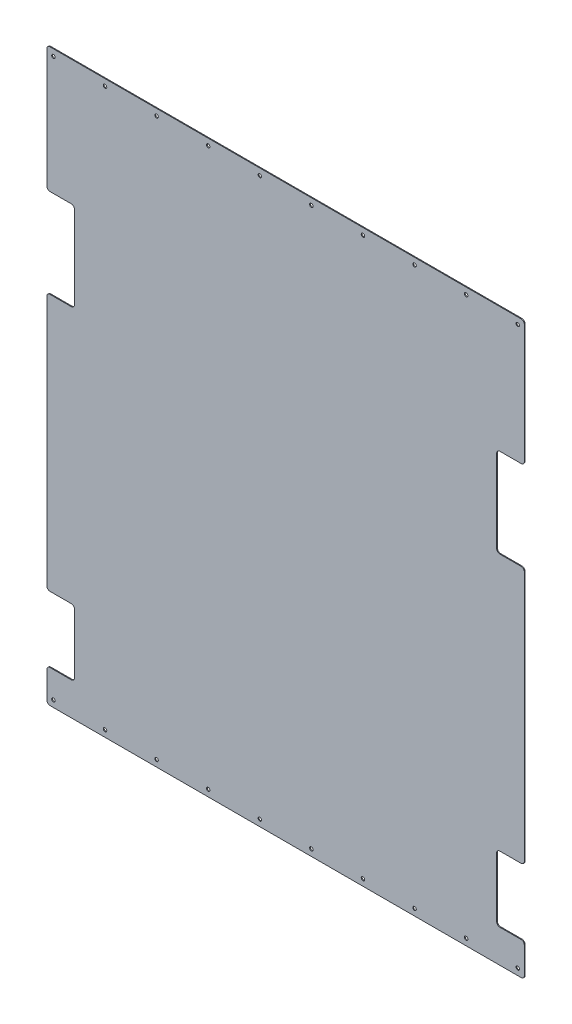
from build123d import *

# Parameters (mm, degrees)
SKETCH1_W           = 724
SKETCH1_H           = 865
BOSS_EXTRUDE1_DEPTH = 1.27
SKETCH2_W           = 42
SKETCH2_H           = 135
SKETCH2_H_2         = 100
CUT_EXTRUDE1_DEPTH  = 1.27
SKETCH3_R           = 2.65
CUT_EXTRUDE2_DEPTH  = 1.27
LPATTERN1_COUNT     = 10
LPATTERN1_PITCH     = 78.222222222
FILLET1_R           = 5


with BuildPart() as part:
    # Sketch1 → Boss-Extrude1 (new body)
    with BuildSketch(Plane.XY):
        Rectangle(SKETCH1_W, SKETCH1_H)
    extrude(amount=BOSS_EXTRUDE1_DEPTH)

    # Sketch2 → Cut-Extrude1 (cut)
    with BuildSketch(Plane.XY.offset(1.27)):
        with Locations((-341, 175)):
            Rectangle(SKETCH2_W, SKETCH2_H)
        with Locations((-341, -332.5)):
            Rectangle(SKETCH2_W, SKETCH2_H_2)
        with Locations((341, 175)):
            Rectangle(SKETCH2_W, SKETCH2_H)
        with Locations((341, -332.5)):
            Rectangle(SKETCH2_W, SKETCH2_H_2)
    extrude(amount=-CUT_EXTRUDE1_DEPTH, mode=Mode.SUBTRACT)

    # Sketch3 → Cut-Extrude2 (cut)
    with BuildSketch(Plane.XY.offset(1.27)):
        with Locations((-352, 422.5)):
            Circle(SKETCH3_R)
        with Locations((-352, -422.5)):
            Circle(SKETCH3_R)
    cut_extrude2 = extrude(amount=-CUT_EXTRUDE2_DEPTH, mode=Mode.SUBTRACT)

    # LPattern1: Cut-Extrude2 ×10
    with Locations(*[(i * LPATTERN1_PITCH, 0, 0) for i in range(1, LPATTERN1_COUNT)]):
        add(cut_extrude2, mode=Mode.SUBTRACT)

    # Fillet1
    fillet1_edges = [part.edges().sort_by_distance(p)[0] for p in [
        (-362, -382.5, 0.635),
        (-362, -282.5, 0.635),
        (-320, -282.5, 0.635),
        (-320, -382.5, 0.635),
        (362, 242.5, 0.635),
        (362, 107.5, 0.635),
        (320, 107.5, 0.635),
        (320, 242.5, 0.635),
        (362, -282.5, 0.635),
        (362, -382.5, 0.635),
        (320, -382.5, 0.635),
        (320, -282.5, 0.635),
        (-362, 107.5, 0.635),
        (-362, 242.5, 0.635),
        (-320, 242.5, 0.635),
        (-320, 107.5, 0.635),
        (-362, 432.5, 0.635),
        (362, 432.5, 0.635),
        (362, -432.5, 0.635),
        (-362, -432.5, 0.635),
    ]]
    fillet(fillet1_edges, radius=FILLET1_R)


solid = part.part
